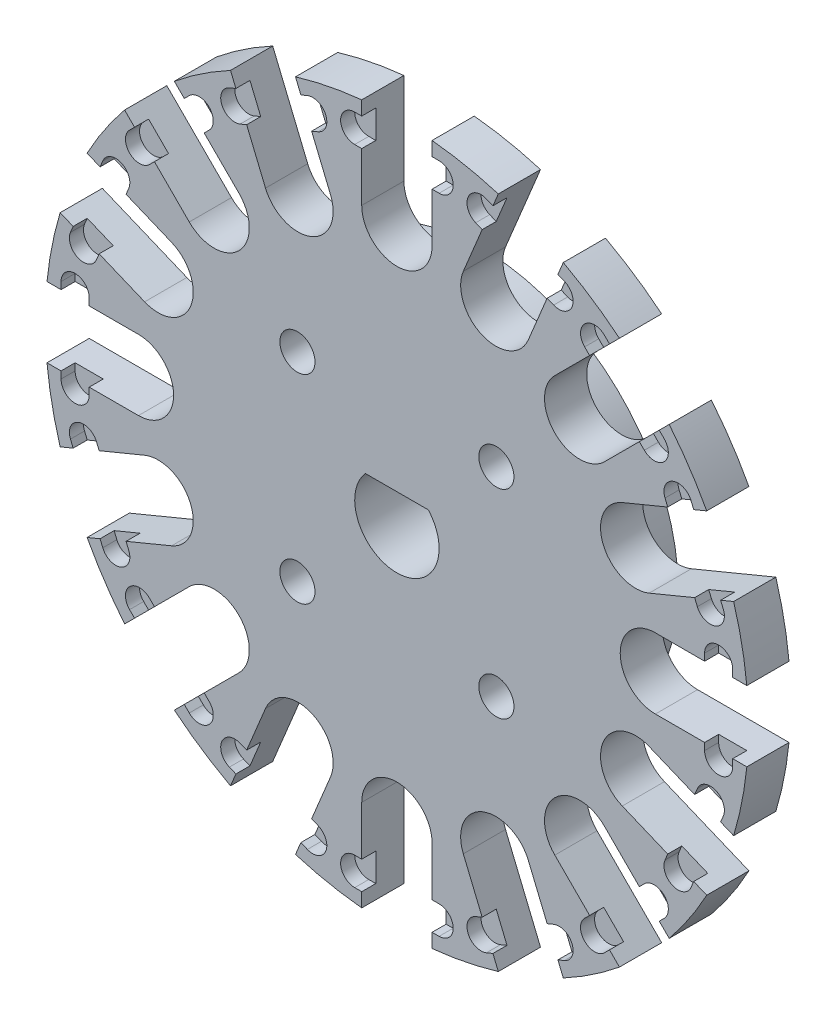
from build123d import *
from build123d.topology import SkipClean

# Parameters (mm, degrees)
ESQUISSE1_R           = 25
EXTRUSION1_DEPTH      = 3
EXTRUSION3_START      = -10
EXTRUSION3_DEPTH      = 10
TROU_TARAUD_M3X0_51_D = 2.5
EXTRUSION6_START      = 3
ESQUISSE9_R           = 14
ESQUISSE9_R_2         = 2.75
EXTRUSION6_DEPTH      = 3
EXTRUSION5_DEPTH      = 1


with BuildPart() as part:
    # Esquisse1 → Extrusion1 (new body)
    with BuildSketch(Plane.XY):
        Circle(ESQUISSE1_R)
    extrude(amount=EXTRUSION1_DEPTH)

    # Esquisse2 → Extrusion3 (cut)
    with BuildSketch(Plane.XY.offset(3).offset(EXTRUSION3_START)):
        with BuildLine():
            Line((-2.236067977, 2), (2.236067977, 2))
            ThreePointArc((2.236067977, 2), (0, -3), (-2.236067977, 2))
        make_face()
        with BuildLine():
            Line((-2.5, 24.874685928), (-2.5, 18.374685928))
            ThreePointArc((-2.5, 18.374685928), (0, 15.874685928), (2.5, 18.374685928))
            Line((2.5, 18.374685928), (2.5, 24.874685928))
            ThreePointArc((2.5, 24.874685928), (0, 25), (-2.5, 24.874685928))
        make_face()
        with BuildLine():
            Line((7.209431359, 23.937921787), (4.721989048, 17.932704826))
            ThreePointArc((4.721989048, 17.932704826), (6.074979299, 14.666297414), (9.341386711, 16.019287664))
            Line((9.341386711, 16.019287664), (11.828829021, 22.024504625))
            ThreePointArc((11.828829021, 22.024504625), (9.567085809, 23.096988313), (7.209431359, 23.937921787))
        make_face()
        with BuildLine():
            Line((15.821292146, 19.356826052), (11.225098069, 14.760631975))
            ThreePointArc((11.225098069, 14.760631975), (11.225098069, 11.225098069), (14.760631975, 11.225098069))
            Line((14.760631975, 11.225098069), (19.356826052, 15.821292146))
            ThreePointArc((19.356826052, 15.821292146), (17.67766953, 17.67766953), (15.821292146, 19.356826052))
        make_face()
        with BuildLine():
            Line((22.024504625, 11.828829021), (16.019287664, 9.341386711))
            ThreePointArc((16.019287664, 9.341386711), (14.666297414, 6.074979299), (17.932704826, 4.721989048))
            Line((17.932704826, 4.721989048), (23.937921787, 7.209431359))
            ThreePointArc((23.937921787, 7.209431359), (23.096988313, 9.567085809), (22.024504625, 11.828829021))
        make_face()
        with BuildLine():
            Line((24.874685928, 2.5), (18.374685928, 2.5))
            ThreePointArc((18.374685928, 2.5), (15.874685928, 0), (18.374685928, -2.5))
            Line((18.374685928, -2.5), (24.874685928, -2.5))
            ThreePointArc((24.874685928, -2.5), (25, 0), (24.874685928, 2.5))
        make_face()
        with BuildLine():
            Line((23.937921787, -7.209431359), (17.932704826, -4.721989048))
            ThreePointArc((17.932704826, -4.721989048), (14.666297414, -6.074979299), (16.019287664, -9.341386711))
            Line((16.019287664, -9.341386711), (22.024504625, -11.828829021))
            ThreePointArc((22.024504625, -11.828829021), (23.096988313, -9.567085809), (23.937921787, -7.209431359))
        make_face()
        with BuildLine():
            Line((19.356826052, -15.821292146), (14.760631975, -11.225098069))
            ThreePointArc((14.760631975, -11.225098069), (11.225098069, -11.225098069), (11.225098069, -14.760631975))
            Line((11.225098069, -14.760631975), (15.821292146, -19.356826052))
            ThreePointArc((15.821292146, -19.356826052), (17.67766953, -17.67766953), (19.356826052, -15.821292146))
        make_face()
        with BuildLine():
            Line((11.828829021, -22.024504625), (9.341386711, -16.019287664))
            ThreePointArc((9.341386711, -16.019287664), (6.074979299, -14.666297414), (4.721989048, -17.932704826))
            Line((4.721989048, -17.932704826), (7.209431359, -23.937921787))
            ThreePointArc((7.209431359, -23.937921787), (9.567085809, -23.096988313), (11.828829021, -22.024504625))
        make_face()
        with BuildLine():
            Line((2.5, -24.874685928), (2.5, -18.374685928))
            ThreePointArc((2.5, -18.374685928), (0, -15.874685928), (-2.5, -18.374685928))
            Line((-2.5, -18.374685928), (-2.5, -24.874685928))
            ThreePointArc((-2.5, -24.874685928), (0, -25), (2.5, -24.874685928))
        make_face()
        with BuildLine():
            Line((-7.209431359, -23.937921787), (-4.721989048, -17.932704826))
            ThreePointArc((-4.721989048, -17.932704826), (-6.074979299, -14.666297414), (-9.341386711, -16.019287664))
            Line((-9.341386711, -16.019287664), (-11.828829021, -22.024504625))
            ThreePointArc((-11.828829021, -22.024504625), (-9.567085809, -23.096988313), (-7.209431359, -23.937921787))
        make_face()
        with BuildLine():
            Line((-15.821292146, -19.356826052), (-11.225098069, -14.760631975))
            ThreePointArc((-11.225098069, -14.760631975), (-11.225098069, -11.225098069), (-14.760631975, -11.225098069))
            Line((-14.760631975, -11.225098069), (-19.356826052, -15.821292146))
            ThreePointArc((-19.356826052, -15.821292146), (-17.67766953, -17.67766953), (-15.821292146, -19.356826052))
        make_face()
        with BuildLine():
            Line((-22.024504625, -11.828829021), (-16.019287664, -9.341386711))
            ThreePointArc((-16.019287664, -9.341386711), (-14.666297414, -6.074979299), (-17.932704826, -4.721989048))
            Line((-17.932704826, -4.721989048), (-23.937921787, -7.209431359))
            ThreePointArc((-23.937921787, -7.209431359), (-23.096988313, -9.567085809), (-22.024504625, -11.828829021))
        make_face()
        with BuildLine():
            Line((-24.874685928, -2.5), (-18.374685928, -2.5))
            ThreePointArc((-18.374685928, -2.5), (-15.874685928, 0), (-18.374685928, 2.5))
            Line((-18.374685928, 2.5), (-24.874685928, 2.5))
            ThreePointArc((-24.874685928, 2.5), (-25, 0), (-24.874685928, -2.5))
        make_face()
        with BuildLine():
            Line((-23.937921787, 7.209431359), (-17.932704826, 4.721989048))
            ThreePointArc((-17.932704826, 4.721989048), (-14.666297414, 6.074979299), (-16.019287664, 9.341386711))
            Line((-16.019287664, 9.341386711), (-22.024504625, 11.828829021))
            ThreePointArc((-22.024504625, 11.828829021), (-23.096988313, 9.567085809), (-23.937921787, 7.209431359))
        make_face()
        with BuildLine():
            Line((-19.356826052, 15.821292146), (-14.760631975, 11.225098069))
            ThreePointArc((-14.760631975, 11.225098069), (-11.225098069, 11.225098069), (-11.225098069, 14.760631975))
            Line((-11.225098069, 14.760631975), (-15.821292146, 19.356826052))
            ThreePointArc((-15.821292146, 19.356826052), (-17.67766953, 17.67766953), (-19.356826052, 15.821292146))
        make_face()
        with BuildLine():
            Line((-11.828829021, 22.024504625), (-9.341386711, 16.019287664))
            ThreePointArc((-9.341386711, 16.019287664), (-6.074979299, 14.666297414), (-4.721989048, 17.932704826))
            Line((-4.721989048, 17.932704826), (-7.209431359, 23.937921787))
            ThreePointArc((-7.209431359, 23.937921787), (-9.567085809, 23.096988313), (-11.828829021, 22.024504625))
        make_face()
    extrude(amount=EXTRUSION3_DEPTH, mode=Mode.SUBTRACT)

    # Trou taraudé M3x0.51 (through all)
    with Locations(Plane(origin=(-7.071067812, 7.071067812, 3), x_dir=(1, 0, 0), z_dir=(0, 0, 1))):
        with Locations((0, 0), (14.142135624, 0), (14.142135624, -14.142135624), (0, -14.142135624)):
            Hole(TROU_TARAUD_M3X0_51_D / 2)

    # Esquisse9 → Extrusion6 (add)
    with SkipClean():  # the faces are left unmerged after this step: merging them gives an invalid solid
        with BuildSketch(Plane(origin=(0, 0, 0), x_dir=(-1, 0, 0), z_dir=(0, 0, -1)).offset(EXTRUSION6_START)):
            with Locations(Location((0, 0, 0), (0, 0, 180))):
                Circle(ESQUISSE9_R)
            with Locations((-7.071067812, 7.071067812)):
                Circle(ESQUISSE9_R_2, mode=Mode.SUBTRACT)
            with Locations((7.071067812, 7.071067812)):
                Circle(ESQUISSE9_R_2, mode=Mode.SUBTRACT)
            with Locations((7.071067812, -7.071067812)):
                Circle(ESQUISSE9_R_2, mode=Mode.SUBTRACT)
            with Locations((-7.071067812, -7.071067812)):
                Circle(ESQUISSE9_R_2, mode=Mode.SUBTRACT)
            with BuildLine():
                Line((-2.236067977, 2), (2.236067977, 2))
                ThreePointArc((2.236067977, 2), (0, -3), (-2.236067977, 2))
            make_face(mode=Mode.SUBTRACT)
        extrude(amount=-EXTRUSION6_DEPTH)

    # Esquisse8 → Extrusion5 (cut)
    with SkipClean():  # the faces are left unmerged after this step: merging them gives an invalid solid
        with BuildSketch(Plane.XY.offset(3)):
            with BuildLine():
                Line((-2.5, 23.874685928), (-3, 23.874685928))
                ThreePointArc((-3, 23.874685928), (-4, 22.874685928), (-3, 21.874685928))
                Line((-3, 21.874685928), (-2.5, 21.874685928))
                Line((-2.5, 21.874685928), (-2.5, 23.874685928))
            make_face()
            with BuildLine():
                Line((6.826747926, 23.014042255), (6.36480816, 23.205383971))
                ThreePointArc((6.36480816, 23.205383971), (5.058245195, 22.664187871), (5.599441295, 21.357624906))
                Line((5.599441295, 21.357624906), (6.061381061, 21.16628319))
                Line((6.061381061, 21.16628319), (6.826747926, 23.014042255))
            make_face()
            with BuildLine():
                Line((2.5, 23.874685928), (3, 23.874685928))
                ThreePointArc((3, 23.874685928), (4, 22.874685928), (3, 21.874685928))
                Line((3, 21.874685928), (2.5, 21.874685928))
                Line((2.5, 21.874685928), (2.5, 23.874685928))
            make_face()
            with BuildLine():
                Line((11.446145589, 21.100625093), (11.908085355, 20.909283377))
                ThreePointArc((11.908085355, 20.909283377), (12.449281455, 19.602720412), (11.14271849, 19.061524312))
                Line((11.14271849, 19.061524312), (10.680778724, 19.252866028))
                Line((10.680778724, 19.252866028), (11.446145589, 21.100625093))
            make_face()
            with BuildLine():
                Line((15.114185365, 18.649719271), (14.760631975, 19.003272662))
                ThreePointArc((14.760631975, 19.003272662), (13.346418412, 19.003272662), (13.346418412, 17.589059099))
                Line((13.346418412, 17.589059099), (13.699971803, 17.235505709))
                Line((13.699971803, 17.235505709), (15.114185365, 18.649719271))
            make_face()
            with BuildLine():
                Line((18.649719271, 15.114185365), (19.003272662, 14.760631975))
                ThreePointArc((19.003272662, 14.760631975), (19.003272662, 13.346418412), (17.589059099, 13.346418412))
                Line((17.589059099, 13.346418412), (17.235505709, 13.699971803))
                Line((17.235505709, 13.699971803), (18.649719271, 15.114185365))
            make_face()
            with BuildLine():
                Line((21.100625093, 11.446145589), (20.909283377, 11.908085355))
                ThreePointArc((20.909283377, 11.908085355), (19.602720412, 12.449281455), (19.061524312, 11.14271849))
                Line((19.061524312, 11.14271849), (19.252866028, 10.680778724))
                Line((19.252866028, 10.680778724), (21.100625093, 11.446145589))
            make_face()
            with BuildLine():
                Line((23.014042255, 6.826747926), (23.205383971, 6.36480816))
                ThreePointArc((23.205383971, 6.36480816), (22.664187871, 5.058245195), (21.357624906, 5.599441295))
                Line((21.357624906, 5.599441295), (21.16628319, 6.061381061))
                Line((21.16628319, 6.061381061), (23.014042255, 6.826747926))
            make_face()
            with BuildLine():
                Line((23.874685928, 2.5), (23.874685928, 3))
                ThreePointArc((23.874685928, 3), (22.874685928, 4), (21.874685928, 3))
                Line((21.874685928, 3), (21.874685928, 2.5))
                Line((21.874685928, 2.5), (23.874685928, 2.5))
            make_face()
            with BuildLine():
                Line((23.874685928, -2.5), (23.874685928, -3))
                ThreePointArc((23.874685928, -3), (22.874685928, -4), (21.874685928, -3))
                Line((21.874685928, -3), (21.874685928, -2.5))
                Line((21.874685928, -2.5), (23.874685928, -2.5))
            make_face()
            with BuildLine():
                Line((23.014042255, -6.826747926), (23.205383971, -6.36480816))
                ThreePointArc((23.205383971, -6.36480816), (22.664187871, -5.058245195), (21.357624906, -5.599441295))
                Line((21.357624906, -5.599441295), (21.16628319, -6.061381061))
                Line((21.16628319, -6.061381061), (23.014042255, -6.826747926))
            make_face()
            with BuildLine():
                Line((21.100625093, -11.446145589), (20.909283377, -11.908085355))
                ThreePointArc((20.909283377, -11.908085355), (19.602720412, -12.449281455), (19.061524312, -11.14271849))
                Line((19.061524312, -11.14271849), (19.252866028, -10.680778724))
                Line((19.252866028, -10.680778724), (21.100625093, -11.446145589))
            make_face()
            with BuildLine():
                Line((18.649719271, -15.114185365), (19.003272662, -14.760631975))
                ThreePointArc((19.003272662, -14.760631975), (19.003272662, -13.346418412), (17.589059099, -13.346418412))
                Line((17.589059099, -13.346418412), (17.235505709, -13.699971803))
                Line((17.235505709, -13.699971803), (18.649719271, -15.114185365))
            make_face()
            with BuildLine():
                Line((15.114185365, -18.649719271), (14.760631975, -19.003272662))
                ThreePointArc((14.760631975, -19.003272662), (13.346418412, -19.003272662), (13.346418412, -17.589059099))
                Line((13.346418412, -17.589059099), (13.699971803, -17.235505709))
                Line((13.699971803, -17.235505709), (15.114185365, -18.649719271))
            make_face()
            with BuildLine():
                Line((11.446145589, -21.100625093), (11.908085355, -20.909283377))
                ThreePointArc((11.908085355, -20.909283377), (12.449281455, -19.602720412), (11.14271849, -19.061524312))
                Line((11.14271849, -19.061524312), (10.680778724, -19.252866028))
                Line((10.680778724, -19.252866028), (11.446145589, -21.100625093))
            make_face()
            with BuildLine():
                Line((6.826747926, -23.014042255), (6.36480816, -23.205383971))
                ThreePointArc((6.36480816, -23.205383971), (5.058245195, -22.664187871), (5.599441295, -21.357624906))
                Line((5.599441295, -21.357624906), (6.061381061, -21.16628319))
                Line((6.061381061, -21.16628319), (6.826747926, -23.014042255))
            make_face()
            with BuildLine():
                Line((2.5, -23.874685928), (3, -23.874685928))
                ThreePointArc((3, -23.874685928), (4, -22.874685928), (3, -21.874685928))
                Line((3, -21.874685928), (2.5, -21.874685928))
                Line((2.5, -21.874685928), (2.5, -23.874685928))
            make_face()
            with BuildLine():
                Line((-2.5, -23.874685928), (-3, -23.874685928))
                ThreePointArc((-3, -23.874685928), (-4, -22.874685928), (-3, -21.874685928))
                Line((-3, -21.874685928), (-2.5, -21.874685928))
                Line((-2.5, -21.874685928), (-2.5, -23.874685928))
            make_face()
            with BuildLine():
                Line((-6.826747926, -23.014042255), (-6.36480816, -23.205383971))
                ThreePointArc((-6.36480816, -23.205383971), (-5.058245195, -22.664187871), (-5.599441295, -21.357624906))
                Line((-5.599441295, -21.357624906), (-6.061381061, -21.16628319))
                Line((-6.061381061, -21.16628319), (-6.826747926, -23.014042255))
            make_face()
            with BuildLine():
                Line((-11.446145589, -21.100625093), (-11.908085355, -20.909283377))
                ThreePointArc((-11.908085355, -20.909283377), (-12.449281455, -19.602720412), (-11.14271849, -19.061524312))
                Line((-11.14271849, -19.061524312), (-10.680778724, -19.252866028))
                Line((-10.680778724, -19.252866028), (-11.446145589, -21.100625093))
            make_face()
            with BuildLine():
                Line((-15.114185365, -18.649719271), (-14.760631975, -19.003272662))
                ThreePointArc((-14.760631975, -19.003272662), (-13.346418412, -19.003272662), (-13.346418412, -17.589059099))
                Line((-13.346418412, -17.589059099), (-13.699971803, -17.235505709))
                Line((-13.699971803, -17.235505709), (-15.114185365, -18.649719271))
            make_face()
            with BuildLine():
                Line((-18.649719271, -15.114185365), (-19.003272662, -14.760631975))
                ThreePointArc((-19.003272662, -14.760631975), (-19.003272662, -13.346418412), (-17.589059099, -13.346418412))
                Line((-17.589059099, -13.346418412), (-17.235505709, -13.699971803))
                Line((-17.235505709, -13.699971803), (-18.649719271, -15.114185365))
            make_face()
            with BuildLine():
                Line((-21.100625093, -11.446145589), (-20.909283377, -11.908085355))
                ThreePointArc((-20.909283377, -11.908085355), (-19.602720412, -12.449281455), (-19.061524312, -11.14271849))
                Line((-19.061524312, -11.14271849), (-19.252866028, -10.680778724))
                Line((-19.252866028, -10.680778724), (-21.100625093, -11.446145589))
            make_face()
            with BuildLine():
                Line((-23.014042255, -6.826747926), (-23.205383971, -6.36480816))
                ThreePointArc((-23.205383971, -6.36480816), (-22.664187871, -5.058245195), (-21.357624906, -5.599441295))
                Line((-21.357624906, -5.599441295), (-21.16628319, -6.061381061))
                Line((-21.16628319, -6.061381061), (-23.014042255, -6.826747926))
            make_face()
            with BuildLine():
                Line((-23.874685928, -2.5), (-23.874685928, -3))
                ThreePointArc((-23.874685928, -3), (-22.874685928, -4), (-21.874685928, -3))
                Line((-21.874685928, -3), (-21.874685928, -2.5))
                Line((-21.874685928, -2.5), (-23.874685928, -2.5))
            make_face()
            with BuildLine():
                Line((-23.874685928, 2.5), (-23.874685928, 3))
                ThreePointArc((-23.874685928, 3), (-22.874685928, 4), (-21.874685928, 3))
                Line((-21.874685928, 3), (-21.874685928, 2.5))
                Line((-21.874685928, 2.5), (-23.874685928, 2.5))
            make_face()
            with BuildLine():
                Line((-23.014042255, 6.826747926), (-23.205383971, 6.36480816))
                ThreePointArc((-23.205383971, 6.36480816), (-22.664187871, 5.058245195), (-21.357624906, 5.599441295))
                Line((-21.357624906, 5.599441295), (-21.16628319, 6.061381061))
                Line((-21.16628319, 6.061381061), (-23.014042255, 6.826747926))
            make_face()
            with BuildLine():
                Line((-21.100625093, 11.446145589), (-20.909283377, 11.908085355))
                ThreePointArc((-20.909283377, 11.908085355), (-19.602720412, 12.449281455), (-19.061524312, 11.14271849))
                Line((-19.061524312, 11.14271849), (-19.252866028, 10.680778724))
                Line((-19.252866028, 10.680778724), (-21.100625093, 11.446145589))
            make_face()
            with BuildLine():
                Line((-18.649719271, 15.114185365), (-19.003272662, 14.760631975))
                ThreePointArc((-19.003272662, 14.760631975), (-19.003272662, 13.346418412), (-17.589059099, 13.346418412))
                Line((-17.589059099, 13.346418412), (-17.235505709, 13.699971803))
                Line((-17.235505709, 13.699971803), (-18.649719271, 15.114185365))
            make_face()
            with BuildLine():
                Line((-15.114185365, 18.649719271), (-14.760631975, 19.003272662))
                ThreePointArc((-14.760631975, 19.003272662), (-13.346418412, 19.003272662), (-13.346418412, 17.589059099))
                Line((-13.346418412, 17.589059099), (-13.699971803, 17.235505709))
                Line((-13.699971803, 17.235505709), (-15.114185365, 18.649719271))
            make_face()
            with BuildLine():
                Line((-11.446145589, 21.100625093), (-11.908085355, 20.909283377))
                ThreePointArc((-11.908085355, 20.909283377), (-12.449281455, 19.602720412), (-11.14271849, 19.061524312))
                Line((-11.14271849, 19.061524312), (-10.680778724, 19.252866028))
                Line((-10.680778724, 19.252866028), (-11.446145589, 21.100625093))
            make_face()
            with BuildLine():
                Line((-6.826747926, 23.014042255), (-6.36480816, 23.205383971))
                ThreePointArc((-6.36480816, 23.205383971), (-5.058245195, 22.664187871), (-5.599441295, 21.357624906))
                Line((-5.599441295, 21.357624906), (-6.061381061, 21.16628319))
                Line((-6.061381061, 21.16628319), (-6.826747926, 23.014042255))
            make_face()
        extrude(amount=-EXTRUSION5_DEPTH, mode=Mode.SUBTRACT)


solid = part.part
